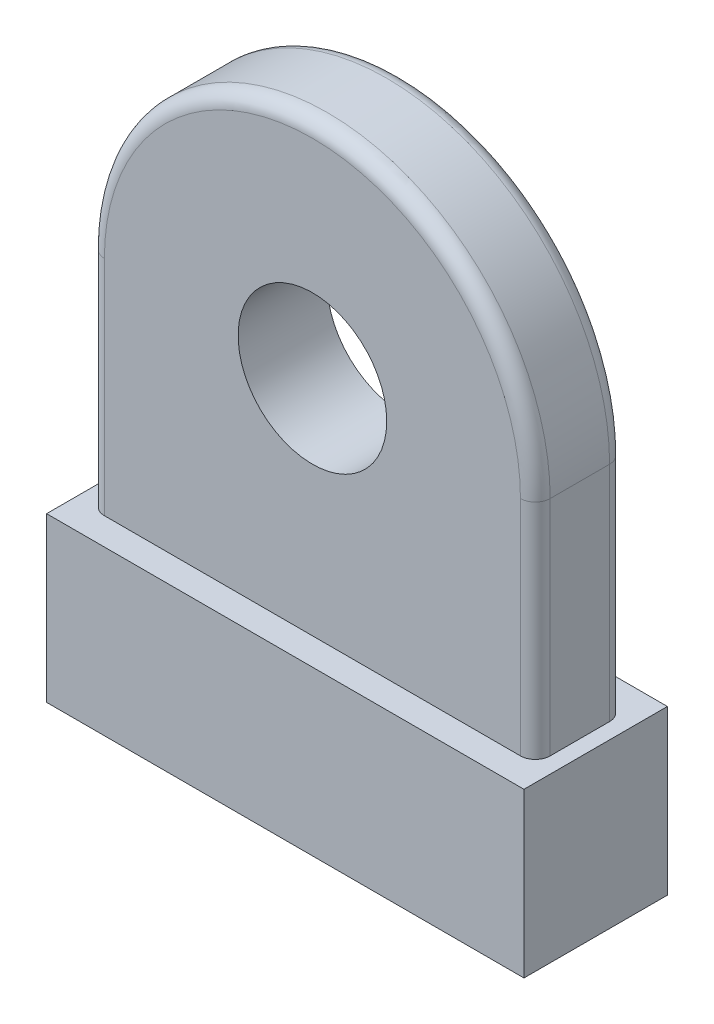
from build123d import *

# Parameters (mm, degrees)
SKETCH1_R           = 5
BOSS_EXTRUDE1_DEPTH = 6
FILLET1_R           = 1
SKETCH2_W           = 32.125499546
SKETCH2_H           = 9.652373674
BOSS_EXTRUDE2_DEPTH = 11


with BuildPart() as part:
    # Sketch1 → Boss-Extrude1 (new body)
    with BuildSketch(Plane.XY):
        with BuildLine():
            Line((-15, 0), (-15, -15))
            Line((-15, -15), (15, -15))
            Line((15, -15), (15, 0))
            ThreePointArc((15, 0), (0, 15), (-15, 0))
        make_face()
        Circle(SKETCH1_R, mode=Mode.SUBTRACT)
    extrude(amount=BOSS_EXTRUDE1_DEPTH)

    # Fillet1
    fillet1_edges = [part.edges().sort_by_distance(p)[0] for p in [
        (15, -7.5, 6),
        (0, 15, 6),
        (15, -7.5, 0),
        (-15, -7.5, 0),
        (0, 15, 0),
        (-15, -7.5, 6),
    ]]
    fillet(fillet1_edges, radius=FILLET1_R)

    # Sketch2 → Boss-Extrude2 (add)
    with BuildSketch(Plane.XZ.offset(15)):
        with Locations((0, 3)):
            Rectangle(SKETCH2_W, SKETCH2_H)
    extrude(amount=BOSS_EXTRUDE2_DEPTH)


solid = part.part
